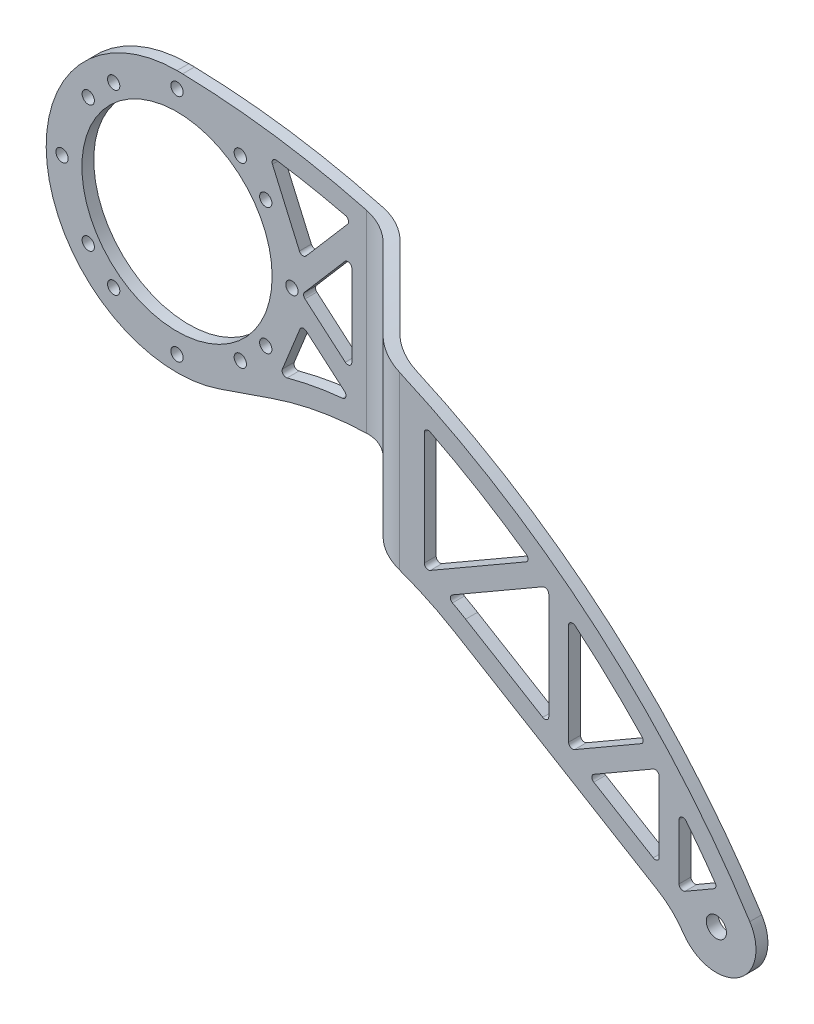
from build123d import *

# Parameters (mm, degrees)
EXTRUDE_1_DEPTH          = 3
EXTRUDE_1_DEPTH_BACK     = 21
SKETCH_1_R               = 2.55
CUT_EXTRUDE_3_DEPTH      = 185.345637541
CUT_EXTRUDE_3_DEPTH_BACK = 185.345637541
SKETCH_2_R               = 1.55
CUT_EXTRUDE_1_DEPTH      = 185.711434636
SKETCH_4_R               = 1.55
CUT_EXTRUDE_2_DEPTH      = 185.711434636
FILLET_2_R               = 10
SKETCH_10_R              = 24
CUT_EXTRUDE_5_DEPTH      = 185.711434636
CUT_EXTRUDE_6_DEPTH      = 185.345637553
CUT_EXTRUDE_7_DEPTH      = 185.711434636


with BuildPart() as part:
    # 草图1 → 凸台-拉伸1 (new, two sides: drawn at the far end of the back side and taken through both)
    with BuildSketch(Plane.XY.offset(-EXTRUDE_1_DEPTH_BACK)):
        with BuildLine():
            Line((10.730362356, -31.206719208), (23.987000348, -26.648453139))
            ThreePointArc((23.987000348, -26.648453139), (58.3964084, -22.742948884), (91.232460283, -33.745404185))
            Line((91.232460283, -33.745404185), (142.367635598, -64.500382059))
            ThreePointArc((142.367635598, -64.500382059), (145.885654628, -67.188078585), (148.726187194, -70.583891486))
            ThreePointArc((148.726187194, -70.583891486), (162.505343691, -73.443257489), (165.49953058, -59.692767585))
            ThreePointArc((165.49953058, -59.692767585), (95.05641772, 7.182197604), (1.414573065, 32.983322541))
            ThreePointArc((1.414573065, 32.983322541), (0.707335687, 32.99583049), (0, 33))
            ThreePointArc((0, 33), (-32.548592395, -5.439589421), (10.730362356, -31.206719208))
        make_face()
        with Locations((157.059520527, -65.056183502)):
            Circle(SKETCH_1_R, mode=Mode.SUBTRACT)
    extrude(amount=EXTRUDE_1_DEPTH + EXTRUDE_1_DEPTH_BACK)

    # 草图6 → 切除-拉伸3 (cut, two sides: drawn at the far end of the back side and taken through both)
    with BuildSketch(Plane(origin=(0, 0, 0), x_dir=(1, 0, 0), z_dir=(0, 1, 0)).offset(-CUT_EXTRUDE_3_DEPTH_BACK)):
        with BuildLine():
            Line((-33, 0), (47.857864376, 0))
            ThreePointArc((47.857864376, 0), (51.6846987, 0.761204675), (54.928932188, 2.928932188))
            Line((54.928932188, 2.928932188), (73, 21))
            Line((73, 21), (-33, 21))
            Line((-33, 21), (-33, 0))
        make_face()
        with BuildLine():
            Line((53.242640687, -3), (71.313708499, 15.071067812))
            ThreePointArc((71.313708499, 15.071067812), (74.557941987, 17.238795325), (78.384776311, 18))
            Line((78.384776311, 18), (167.059520527, 18))
            Line((167.059520527, 18), (167.059520527, -3))
            Line((167.059520527, -3), (53.242640687, -3))
        make_face()
    extrude(amount=CUT_EXTRUDE_3_DEPTH + CUT_EXTRUDE_3_DEPTH_BACK, mode=Mode.SUBTRACT)

    # 草图2 → 切除-拉伸1 (cut, through all)
    with BuildSketch(Plane.XY.offset(3)):
        with Locations((-29, 0)):
            Circle(SKETCH_2_R)
        with Locations((0, -29)):
            Circle(SKETCH_2_R)
        with Locations((0, 29)):
            Circle(SKETCH_2_R)
        with Locations((29, 0)):
            Circle(SKETCH_2_R)
    extrude(amount=-CUT_EXTRUDE_1_DEPTH, mode=Mode.SUBTRACT)

    # 草图4 → 切除-拉伸2 (cut, through all)
    with BuildSketch(Plane.XY.offset(3)):
        with Locations((-22.388176755, 15.969331282)):
            Circle(SKETCH_4_R)
        with Locations((15.969331282, 22.388176755)):
            Circle(SKETCH_4_R)
        with Locations((-15.969331282, -22.388176755)):
            Circle(SKETCH_4_R)
        with Locations((22.388176755, -15.969331282)):
            Circle(SKETCH_4_R)
        with Locations((-15.969331282, 22.388176755)):
            Circle(SKETCH_4_R)
        with Locations((22.388176755, 15.969331282)):
            Circle(SKETCH_4_R)
        with Locations((15.969331282, -22.388176755)):
            Circle(SKETCH_4_R)
        with Locations((-22.388176755, -15.969331282)):
            Circle(SKETCH_4_R)
    extrude(amount=-CUT_EXTRUDE_2_DEPTH, mode=Mode.SUBTRACT)

    # 圆角2
    fillet_2_edges = [part.edges().sort_by_distance(p)[0] for p in [
        (73, -3.883124825, -21),
        (53.242640687, 1.256381871, 3),
    ]]
    fillet(fillet_2_edges, radius=FILLET_2_R)

    # 草图10 → 切除-拉伸5 (cut, through all)
    with BuildSketch(Plane.XY.offset(3)):
        Circle(SKETCH_10_R)
    extrude(amount=-CUT_EXTRUDE_5_DEPTH, mode=Mode.SUBTRACT)

    # 草图12 → 切除-拉伸6 (cut, through all)
    with BuildSketch(Plane.XY.offset(-18)):
        with BuildLine():
            Line((83.384776311, 6.091687583), (83.384776311, -22.39964463))
            ThreePointArc((83.384776311, -22.39964463), (83.884776311, -23.265670034), (84.884776311, -23.265670034))
            Line((84.884776311, -23.265670034), (109.047493079, -9.315319003))
            ThreePointArc((109.047493079, -9.315319003), (109.546460743, -8.494720534), (109.124030004, -7.632222505))
            ThreePointArc((109.124030004, -7.632222505), (97.246327471, 0.117641628), (84.83676315, 6.983712189))
            ThreePointArc((84.83676315, 6.983712189), (83.861319932, 6.943740058), (83.384776311, 6.091687583))
        make_face()
        with BuildLine():
            Line((113.281262253, -12.644453923), (90.464052196, -25.817976291))
            ThreePointArc((90.464052196, -25.817976291), (89.96414418, -26.697564816), (90.487726008, -27.563270347))
            ThreePointArc((90.487726008, -27.563270347), (92.159283091, -28.493281996), (93.809489051, -29.460672836))
            Line((93.809489051, -29.460672836), (113.2658565, -41.162601043))
            ThreePointArc((113.2658565, -41.162601043), (114.27349911, -41.176116075), (114.781262253, -40.305654774))
            Line((114.781262253, -40.305654774), (114.781262253, -13.510479327))
            ThreePointArc((114.781262253, -13.510479327), (114.281262253, -12.644453923), (113.281262253, -12.644453923))
        make_face()
        with BuildLine():
            Line((119.781262253, -17.831363982), (119.781262253, -43.349206201))
            ThreePointArc((119.781262253, -43.349206201), (120.281262253, -44.215231605), (121.281262253, -44.215231605))
            Line((121.281262253, -44.215231605), (138.118809565, -34.494069132))
            ThreePointArc((138.118809565, -34.494069132), (138.608354839, -33.7722663), (138.345198637, -32.940760006))
            ThreePointArc((138.345198637, -32.940760006), (130.119442072, -24.749716604), (121.420859845, -17.062654075))
            ThreePointArc((121.420859845, -17.062654075), (120.356761129, -16.925936572), (119.781262253, -17.831363982))
        make_face()
        with BuildLine():
            Line((126.148561535, -47.178597747), (141.15550656, -38.514333997))
            ThreePointArc((141.15550656, -38.514333997), (142.15550656, -38.514333997), (142.65550656, -39.3803594))
            Line((142.65550656, -39.3803594), (142.65550656, -57.070470024))
            ThreePointArc((142.65550656, -57.070470024), (142.147743417, -57.940931325), (141.140100807, -57.927416293))
            Line((141.140100807, -57.927416293), (126.133155781, -48.90156942))
            ThreePointArc((126.133155781, -48.90156942), (125.648601507, -48.035682123), (126.148561535, -47.178597747))
        make_face()
        with BuildLine():
            Line((147.65550656, -46.357104826), (147.65550656, -60.368443488))
            ThreePointArc((147.65550656, -60.368443488), (148.15550656, -61.234468891), (149.15550656, -61.234468891))
            Line((149.15550656, -61.234468891), (156.444782946, -57.026003208))
            ThreePointArc((156.444782946, -57.026003208), (156.920756292, -56.377867749), (156.765635798, -55.588838072))
            ThreePointArc((156.765635798, -55.588838072), (153.179787293, -50.604451681), (149.438785823, -45.73543482))
            ThreePointArc((149.438785823, -45.73543482), (148.326325199, -45.41283811), (147.65550656, -46.357104826))
        make_face()
    extrude(amount=-CUT_EXTRUDE_6_DEPTH, mode=Mode.SUBTRACT)

    # 草图13 → 切除-拉伸7 (cut, through all)
    with BuildSketch(Plane.XY.offset(3)):
        with BuildLine():
            Line((24.082747749, 24.562528501), (30.890663135, 9.020360956))
            ThreePointArc((30.890663135, 9.020360956), (31.658606615, 8.432604241), (32.56499258, 8.769738674))
            Line((32.56499258, 8.769738674), (43.039867443, 20.956056938))
            ThreePointArc((43.039867443, 20.956056938), (43.233300176, 21.914677314), (42.516477142, 22.579909593))
            ThreePointArc((42.516477142, 22.579909593), (33.868822783, 24.463648028), (25.144600346, 25.953057066))
            ThreePointArc((25.144600346, 25.953057066), (24.203957809, 25.570665357), (24.082747749, 24.562528501))
        make_face()
        with BuildLine():
            Line((44.100505063, -8.734608625), (44.100505063, 11.821995662))
            ThreePointArc((44.100505063, 11.821995662), (43.448103947, 12.759638993), (42.342155031, 12.473843212))
            Line((42.342155031, 12.473843212), (32.180437397, 0.651847549))
            ThreePointArc((32.180437397, 0.651847549), (31.941627156, -0.075308628), (32.28693988, -0.758350033))
            Line((32.28693988, -0.758350033), (42.448657514, -9.492958658))
            ThreePointArc((42.448657514, -9.492958658), (43.517729494, -9.64341211), (44.100505063, -8.734608625))
        make_face()
        with BuildLine():
            Line((32.585299227, -7.608069271), (42.290408687, -15.950195656))
            ThreePointArc((42.290408687, -15.950195656), (42.592011128, -17.01009687), (41.73578717, -17.703808015))
            ThreePointArc((41.73578717, -17.703808015), (34.703564931, -18.688791633), (27.778094538, -20.257294798))
            ThreePointArc((27.778094538, -20.257294798), (26.768536314, -19.955632396), (26.589551396, -18.917281582))
            Line((26.589551396, -18.917281582), (31.006342718, -7.991627393))
            ThreePointArc((31.006342718, -7.991627393), (31.69739783, -7.394679328), (32.585299227, -7.608069271))
        make_face()
    extrude(amount=-CUT_EXTRUDE_7_DEPTH, mode=Mode.SUBTRACT)


with BuildPart() as body_2:
    # 镜向1: mirrored copy
    add(part.part.mirror(Plane(origin=(132.059520527, -81.639307454, 3), x_dir=(1, 0, 0), z_dir=(0, 0, -1))))


solid = body_2.part
